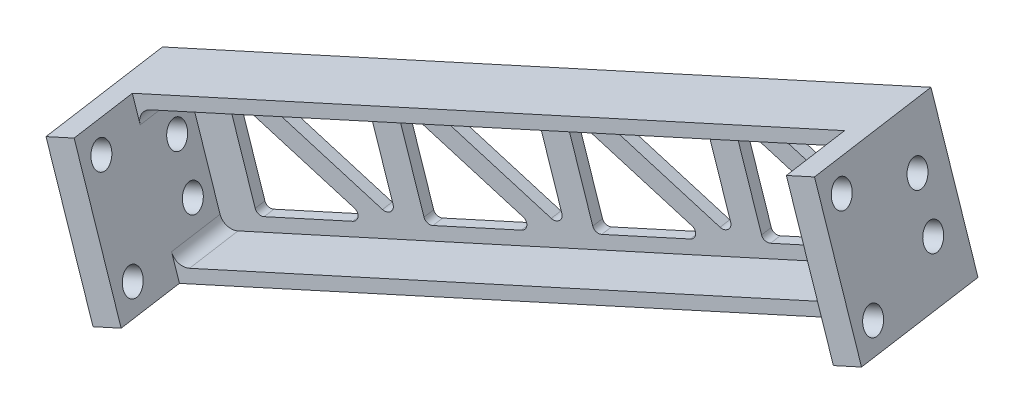
from build123d import *

# Parameters (mm, degrees)
SKETCH1_W                       = 38.1
SKETCH1_H                       = 38.1
BOSS_EXTRUDE1_DEPTH             = 6.35
BOSS_EXTRUDE2_DEPTH             = 167.118447297
SKETCH3_W                       = 38.1
SKETCH3_H                       = 38.1
BOSS_EXTRUDE3_DEPTH             = 6.35
FILLET1_R                       = 3.175
F_1_4_0_25_DIAMETER_HOLE1_D     = 6.35
F_1_4_0_25_DIAMETER_HOLE1_DEPTH = 6.35
F_1_4_0_25_DIAMETER_HOLE2_D     = 6.35
CUT_EXTRUDE1_REACH              = 215.764


with BuildPart() as part:
    # Sketch1 → Boss-Extrude1 (new body)
    with BuildSketch(Plane(origin=(-17.28438521, -5.761461737, 3.840974491), x_dir=(-0.1956984219160322, -0.06523280730534455, -0.9784921095801634), z_dir=(0.9282791216329135, 0.3094263738776401, -0.20628424925175834))):
        Rectangle(SKETCH1_W, SKETCH1_H)
    extrude(amount=-BOSS_EXTRUDE1_DEPTH)

    # Sketch2 → Boss-Extrude2 (add)
    with BuildSketch(Plane(origin=(-23.178957633, -7.726319211, 5.150879474), x_dir=(0.19569842191603226, 0.06523280730534461, 0.9784921095801634), z_dir=(-0.9282791216329135, -0.3094263738776404, 0.20628424925175842))):
        Polygon((-19.05, 19.05), (0, 19.05), (0, 15.875), (-15.875, 15.875), (-15.875, -15.875), (0, -15.875), (0, -19.05), (-19.05, -19.05), align=None)
    extrude(amount=BOSS_EXTRUDE2_DEPTH)

    # Sketch3 → Boss-Extrude3 (add)
    with BuildSketch(Plane(origin=(-178.311523099, -59.437174366, 39.624782911), x_dir=(-0.19569842191603198, -0.0652328073053445, -0.9784921095801634), z_dir=(0.9282791216329136, 0.30942637387764027, -0.20628424925175817))):
        Rectangle(SKETCH3_W, SKETCH3_H)
    extrude(amount=BOSS_EXTRUDE3_DEPTH)

    # Fillet1
    fillet1_edges = [part.edges().sort_by_distance(p)[0] for p in [
        (-29.752429642, 6.816242738, -2.615901646),
        (-19.712198071, -23.304451975, -2.615901646),
        (-178.990422686, -42.929754944, 30.548096808),
        (-168.950191115, -73.050449657, 30.548096808),
    ]]
    fillet(fillet1_edges, radius=FILLET1_R)

    # 1/4 (0.25) Diameter Hole1
    with Locations(Plane(origin=(-17.28438521, -5.761461737, 3.840974491), x_dir=(-0.19569842191603223, -0.0652328073053446, -0.9784921095801634), z_dir=(0.9282791216329135, 0.3094263738776401, -0.20628424925175837))):
        with Locations((-12.7, 12.7), (-12.7, -12.7), (9.525, 6.35), (9.525, -6.35)):
            Hole(F_1_4_0_25_DIAMETER_HOLE1_D / 2, depth=F_1_4_0_25_DIAMETER_HOLE1_DEPTH)

    # 1/4 (0.25) Diameter Hole2 (through all)
    with Locations(Plane(origin=(-178.311523099, -59.437174366, 39.624782911), x_dir=(0.19569842191603223, 0.06523280730534461, 0.9784921095801634), z_dir=(-0.9282791216329135, -0.3094263738776401, 0.2062842492517584))):
        with Locations((12.7, 12.7), (12.7, -12.7), (-9.525, -6.35), (-9.525, 6.35)):
            Hole(F_1_4_0_25_DIAMETER_HOLE2_D / 2)

    # Sketch10 → Cut-Extrude1 (cut, up to next)
    with BuildSketch(Plane(origin=(-3.106712448, -1.035570816, -15.53356224), x_dir=(0.9806641258145292, -0.013017665386918594, -0.19526498080377744), z_dir=(0.1956984219160322, 0.06523280730534471, 0.9784921095801634)), mode=Mode.PRIVATE) as cut_extrude1_sk1:
        with BuildLine():
            Line((-26.787357564, -18.493233536), (-33.230145008, 0.419416497))
            ThreePointArc((-33.230145008, 0.419416497), (-34.032250279, 1.332050316), (-35.244753917, 1.410205802))
            Line((-35.244753917, 1.410205802), (-54.15740395, -5.032581643))
            ThreePointArc((-54.15740395, -5.032581643), (-55.229706496, -6.433165686), (-54.346087984, -7.95982437))
            Line((-54.346087984, -7.95982437), (-28.990650506, -20.429686959))
            ThreePointArc((-28.990650506, -20.429686959), (-27.24205563, -20.197556886), (-26.787357564, -18.493233536))
        make_face()
    cut_extrude1_tool1 = extrude(cut_extrude1_sk1.sketch, amount=-CUT_EXTRUDE1_REACH, mode=Mode.PRIVATE) & part.part
    # Sketch10 → Cut-Extrude1 (cut, up to next)
    with BuildSketch(Plane(origin=(-3.106712448, -1.035570816, -15.53356224), x_dir=(0.9806641258145292, -0.013017665386918594, -0.19526498080377744), z_dir=(0.1956984219160322, 0.06523280730534471, 0.9784921095801634)), mode=Mode.PRIVATE) as cut_extrude1_sk2:
        with BuildLine():
            Line((-35.001446932, -22.477326167), (-60.35688441, -10.007463578))
            ThreePointArc((-60.35688441, -10.007463578), (-62.105479286, -10.239593651), (-62.560177352, -11.943917001))
            Line((-62.560177352, -11.943917001), (-56.117389908, -30.856567035))
            ThreePointArc((-56.117389908, -30.856567035), (-55.315284637, -31.769200853), (-54.102780999, -31.847356339))
            Line((-54.102780999, -31.847356339), (-35.190130966, -25.404568895))
            ThreePointArc((-35.190130966, -25.404568895), (-34.11782842, -24.003984851), (-35.001446932, -22.477326167))
        make_face()
    cut_extrude1_tool2 = extrude(cut_extrude1_sk2.sketch, amount=-CUT_EXTRUDE1_REACH, mode=Mode.PRIVATE) & part.part
    # Sketch10 → Cut-Extrude1 (cut, up to next)
    with BuildSketch(Plane(origin=(-3.106712448, -1.035570816, -15.53356224), x_dir=(0.9806641258145292, -0.013017665386918594, -0.19526498080377744), z_dir=(0.1956984219160322, 0.06523280730534471, 0.9784921095801634)), mode=Mode.PRIVATE) as cut_extrude1_sk3:
        with BuildLine():
            Line((-62.852136119, -30.779068786), (-69.294923563, -11.866418753))
            ThreePointArc((-69.294923563, -11.866418753), (-70.097028834, -10.953784934), (-71.309532471, -10.875629448))
            Line((-71.309532471, -10.875629448), (-90.222182505, -17.318416892))
            ThreePointArc((-90.222182505, -17.318416892), (-91.294485051, -18.719000936), (-90.410866539, -20.24565962))
            Line((-90.410866539, -20.24565962), (-65.055429061, -32.715522209))
            ThreePointArc((-65.055429061, -32.715522209), (-63.306834185, -32.483392136), (-62.852136119, -30.779068786))
        make_face()
    cut_extrude1_tool3 = extrude(cut_extrude1_sk3.sketch, amount=-CUT_EXTRUDE1_REACH, mode=Mode.PRIVATE) & part.part
    # Sketch10 → Cut-Extrude1 (cut, up to next)
    with BuildSketch(Plane(origin=(-3.106712448, -1.035570816, -15.53356224), x_dir=(0.9806641258145292, -0.013017665386918594, -0.19526498080377744), z_dir=(0.1956984219160322, 0.06523280730534471, 0.9784921095801634)), mode=Mode.PRIVATE) as cut_extrude1_sk4:
        with BuildLine():
            Line((-71.066225487, -34.763161417), (-96.421662965, -22.293298828))
            ThreePointArc((-96.421662965, -22.293298828), (-98.170257841, -22.525428901), (-98.624955907, -24.229752251))
            Line((-98.624955907, -24.229752251), (-92.182168463, -43.142402284))
            ThreePointArc((-92.182168463, -43.142402284), (-91.380063192, -44.055036103), (-90.167559554, -44.133191589))
            Line((-90.167559554, -44.133191589), (-71.254909521, -37.690404145))
            ThreePointArc((-71.254909521, -37.690404145), (-70.182606975, -36.289820101), (-71.066225487, -34.763161417))
        make_face()
    cut_extrude1_tool4 = extrude(cut_extrude1_sk4.sketch, amount=-CUT_EXTRUDE1_REACH, mode=Mode.PRIVATE) & part.part
    # Sketch10 → Cut-Extrude1 (cut, up to next)
    with BuildSketch(Plane(origin=(-3.106712448, -1.035570816, -15.53356224), x_dir=(0.9806641258145292, -0.013017665386918594, -0.19526498080377744), z_dir=(0.1956984219160322, 0.06523280730534471, 0.9784921095801634)), mode=Mode.PRIVATE) as cut_extrude1_sk5:
        with BuildLine():
            Line((-98.916914674, -43.064904036), (-105.359702118, -24.152254002))
            ThreePointArc((-105.359702118, -24.152254002), (-106.161807388, -23.239620184), (-107.374311026, -23.161464698))
            Line((-107.374311026, -23.161464698), (-126.28696106, -29.604252142))
            ThreePointArc((-126.28696106, -29.604252142), (-127.359263606, -31.004836186), (-126.475645094, -32.531494869))
            Line((-126.475645094, -32.531494869), (-101.120207616, -45.001357459))
            ThreePointArc((-101.120207616, -45.001357459), (-99.371612739, -44.769227386), (-98.916914674, -43.064904036))
        make_face()
    cut_extrude1_tool5 = extrude(cut_extrude1_sk5.sketch, amount=-CUT_EXTRUDE1_REACH, mode=Mode.PRIVATE) & part.part
    # Sketch10 → Cut-Extrude1 (cut, up to next)
    with BuildSketch(Plane(origin=(-3.106712448, -1.035570816, -15.53356224), x_dir=(0.9806641258145292, -0.013017665386918594, -0.19526498080377744), z_dir=(0.1956984219160322, 0.06523280730534471, 0.9784921095801634)), mode=Mode.PRIVATE) as cut_extrude1_sk6:
        with BuildLine():
            Line((-107.131004042, -47.048996667), (-132.48644152, -34.579134078))
            ThreePointArc((-132.48644152, -34.579134078), (-134.235036396, -34.811264151), (-134.689734462, -36.5155875))
            Line((-134.689734462, -36.5155875), (-128.246947018, -55.428237534))
            ThreePointArc((-128.246947018, -55.428237534), (-127.444841747, -56.340871353), (-126.232338109, -56.419026839))
            Line((-126.232338109, -56.419026839), (-107.319688075, -49.976239394))
            ThreePointArc((-107.319688075, -49.976239394), (-106.247385529, -48.575655351), (-107.131004042, -47.048996667))
        make_face()
    cut_extrude1_tool6 = extrude(cut_extrude1_sk6.sketch, amount=-CUT_EXTRUDE1_REACH, mode=Mode.PRIVATE) & part.part
    # Sketch10 → Cut-Extrude1 (cut, up to next)
    with BuildSketch(Plane(origin=(-3.106712448, -1.035570816, -15.53356224), x_dir=(0.9806641258145292, -0.013017665386918594, -0.19526498080377744), z_dir=(0.1956984219160322, 0.06523280730534471, 0.9784921095801634)), mode=Mode.PRIVATE) as cut_extrude1_sk7:
        with BuildLine():
            Line((-134.981693228, -55.350739286), (-141.424480673, -36.438089252))
            ThreePointArc((-141.424480673, -36.438089252), (-142.226585943, -35.525455434), (-143.439089581, -35.447299948))
            Line((-143.439089581, -35.447299948), (-162.351739615, -41.890087392))
            ThreePointArc((-162.351739615, -41.890087392), (-163.424042161, -43.290671435), (-162.540423649, -44.817330119))
            Line((-162.540423649, -44.817330119), (-137.184986171, -57.287192709))
            ThreePointArc((-137.184986171, -57.287192709), (-135.436391294, -57.055062636), (-134.981693228, -55.350739286))
        make_face()
    cut_extrude1_tool7 = extrude(cut_extrude1_sk7.sketch, amount=-CUT_EXTRUDE1_REACH, mode=Mode.PRIVATE) & part.part
    # Sketch10 → Cut-Extrude1 (cut, up to next)
    with BuildSketch(Plane(origin=(-3.106712448, -1.035570816, -15.53356224), x_dir=(0.9806641258145292, -0.013017665386918594, -0.19526498080377744), z_dir=(0.1956984219160322, 0.06523280730534471, 0.9784921095801634)), mode=Mode.PRIVATE) as cut_extrude1_sk8:
        with BuildLine():
            Line((-143.195782597, -59.334831917), (-168.551220075, -46.864969328))
            ThreePointArc((-168.551220075, -46.864969328), (-170.299814951, -47.0970994), (-170.754513017, -48.80142275))
            Line((-170.754513017, -48.80142275), (-164.311725573, -67.714072784))
            ThreePointArc((-164.311725573, -67.714072784), (-163.509620302, -68.626706603), (-162.297116664, -68.704862089))
            Line((-162.297116664, -68.704862089), (-143.38446663, -62.262074644))
            ThreePointArc((-143.38446663, -62.262074644), (-142.312164084, -60.861490601), (-143.195782597, -59.334831917))
        make_face()
    cut_extrude1_tool8 = extrude(cut_extrude1_sk8.sketch, amount=-CUT_EXTRUDE1_REACH, mode=Mode.PRIVATE) & part.part
    add(cut_extrude1_tool1.solids().sort_by_distance((-41.341778, -9.255249, -7.338571))[0], mode=Mode.SUBTRACT)
    add(cut_extrude1_tool2.solids().sort_by_distance((-52.491569, -22.022534, -4.25746))[0], mode=Mode.SUBTRACT)
    add(cut_extrude1_tool3.solids().sort_by_distance((-76.709213, -21.044393, 0.520859))[0], mode=Mode.SUBTRACT)
    add(cut_extrude1_tool4.solids().sort_by_distance((-87.859003, -33.811679, 3.60197))[0], mode=Mode.SUBTRACT)
    add(cut_extrude1_tool5.solids().sort_by_distance((-112.076647, -32.833538, 8.380289))[0], mode=Mode.SUBTRACT)
    add(cut_extrude1_tool6.solids().sort_by_distance((-123.226438, -45.600823, 11.4614))[0], mode=Mode.SUBTRACT)
    add(cut_extrude1_tool7.solids().sort_by_distance((-147.444082, -44.622683, 16.239719))[0], mode=Mode.SUBTRACT)
    add(cut_extrude1_tool8.solids().sort_by_distance((-158.593872, -57.389968, 19.32083))[0], mode=Mode.SUBTRACT)


solid = part.part
